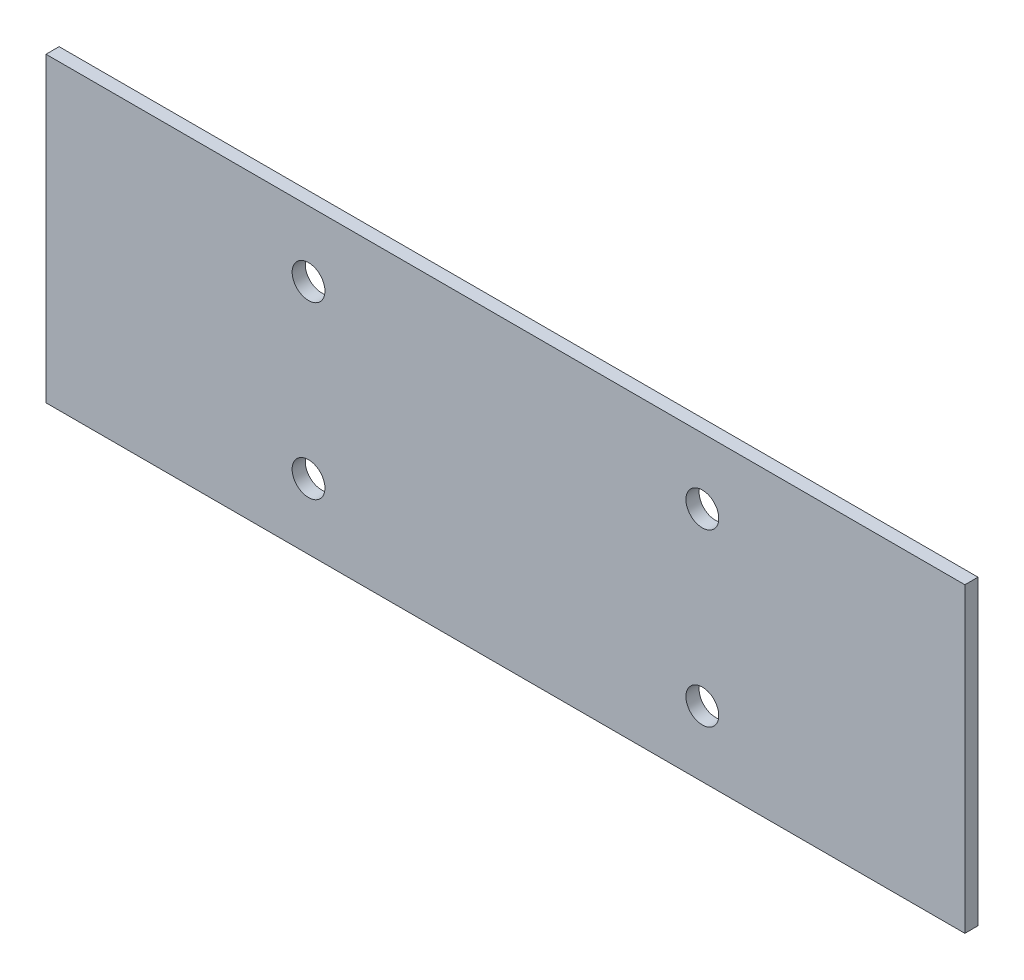
from build123d import *

# Parameters (mm, degrees)
IZIM1_W                     = 140
IZIM1_H                     = 46
IZIM1_R                     = 2.5
Y_KSEKLIK_EKSTR_ZYON1_DEPTH = 2


with BuildPart() as part:
    # Çizim1 → Yükseklik-Ekstrüzyon1 (new body)
    with BuildSketch(Plane.XY):
        with Locations((70, 23)):
            Rectangle(IZIM1_W, IZIM1_H)
        with Locations((40, 36)):
            Circle(IZIM1_R, mode=Mode.SUBTRACT)
        with Locations((100, 36)):
            Circle(IZIM1_R, mode=Mode.SUBTRACT)
        with Locations((40, 10)):
            Circle(IZIM1_R, mode=Mode.SUBTRACT)
        with Locations((100, 10)):
            Circle(IZIM1_R, mode=Mode.SUBTRACT)
    extrude(amount=Y_KSEKLIK_EKSTR_ZYON1_DEPTH)


solid = part.part
